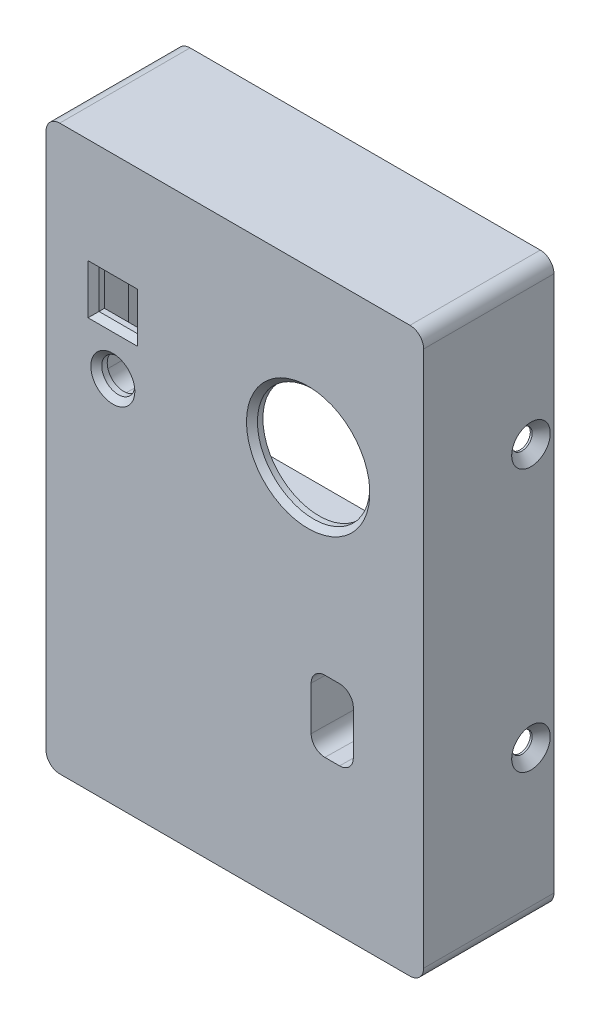
from build123d import *

# Parameters (mm, degrees)
SKETCH2_W            = 69
SKETCH2_H            = 103
BOSS_EXTRUDE1_DEPTH  = 2
SKETCH3_W            = 69
SKETCH3_H            = 103
SKETCH3_W_2          = 65
SKETCH3_H_2          = 99
BOSS_EXTRUDE2_DEPTH  = 21.816
BOSS_EXTRUDE3_DEPTH  = 7.5
SKETCH7_R            = 10.271022242
SKETCH7_R_2          = 3.021022242
SKETCH7_W            = 7.042044484
SKETCH7_H            = 7.042044484
CUT_EXTRUDE1_DEPTH   = 84.899212487
SKETCH9_W            = 1.5
SKETCH9_H            = 7
SKETCH9_H_2          = 8.825
BOSS_EXTRUDE4_DEPTH  = 19.69
BOSS_EXTRUDE5_DEPTH  = 21.3
SKETCH10_W           = 10.7
SKETCH10_H           = 4.1
BOSS_EXTRUDE6_DEPTH  = 15.33
BOSS_EXTRUDE7_DEPTH  = 19.69
SKETCH10_6_W         = 5
SKETCH10_6_H         = 2
BOSS_EXTRUDE8_DEPTH  = 21.3
SKETCH11_W           = 7.5
SKETCH11_H           = 13
CUT_EXTRUDE2_DEPTH   = 84.899212487
FILLET2_R            = 2.5
CHAMFER1_SIZE        = 1
CUT_EXTRUDE3_REACH   = 112.793
SKETCH12_W           = 1
SKETCH12_H           = 11.908
SKETCH13_W           = 12.35
SKETCH13_H           = 16.65
SKETCH13_W_2         = 7.5
SKETCH13_H_2         = 13
BOSS_EXTRUDE9_DEPTH  = 14.69
SKETCH14_W           = 7.5
SKETCH14_H           = 13
BOSS_EXTRUDE10_DEPTH = 5.1
DRAFT1_ANGLE         = 1
FILLET3_R            = 2.5
SKETCH16_W           = 2.65
SKETCH16_H           = 3
SKETCH16_W_2         = 1.65
SKETCH16_W_3         = 2.15
SKETCH16_H_2         = 2.15
BOSS_EXTRUDE12_DEPTH = 22.8
SKETCH16_4_W         = 1.35
SKETCH16_4_H         = 3
BOSS_EXTRUDE13_DEPTH = 23.816
BOSS_EXTRUDE14_DEPTH = 21.816
CUT_EXTRUDE4_DEPTH   = 5.15
CUT_EXTRUDE5_DEPTH   = 5.15
SKETCH19_R           = 1.875
CUT_EXTRUDE6_DEPTH   = 2
CHAMFER5_SIZE        = 1.65
SKETCH20_W           = 15.485542106
SKETCH20_H           = 0.75
CUT_EXTRUDE7_DEPTH   = 3
BOSS_EXTRUDE15_DEPTH = 5
BOSS_EXTRUDE16_DEPTH = 6.61
SKETCH23_W           = 1.5
SKETCH23_H           = 2
CUT_EXTRUDE8_DEPTH   = 1


with BuildPart() as part:
    # Sketch2 → Boss-Extrude1 (new body)
    with BuildSketch(Plane.XY):
        with Locations((0, -21.8)):
            Rectangle(SKETCH2_W, SKETCH2_H)
    extrude(amount=BOSS_EXTRUDE1_DEPTH)

    # Sketch3 → Boss-Extrude2 (add)
    with BuildSketch(Plane(origin=(0, 0, 0), x_dir=(-1, 0, 0), z_dir=(0, 0, -1))):
        with Locations((0, -21.8)):
            Rectangle(SKETCH3_W, SKETCH3_H)
        with Locations((0, -21.8)):
            Rectangle(SKETCH3_W_2, SKETCH3_H_2, mode=Mode.SUBTRACT)
    extrude(amount=BOSS_EXTRUDE2_DEPTH)

    # Sketch4 → Boss-Extrude3 (add)
    with BuildSketch(Plane(origin=(0, 0, 0), x_dir=(-1, 0, 0), z_dir=(0, 0, -1))):
        with BuildLine():
            Line((30.45, -10.5), (30.45, -8.939131361))
            Line((30.45, -8.939131361), (30.45, -8.190100036))
            Line((30.45, -8.190100036), (30.45, -6.895046928))
            Line((30.45, -6.895046928), (30.45, -2.388728371))
            Line((30.45, -2.388728371), (30.45, -1.262895346))
            Line((30.45, -1.262895346), (30.45, 3.240436753))
            Line((30.45, 3.240436753), (30.45, 8.176781555))
            Line((30.45, 8.176781555), (30.45, 9.5))
            ThreePointArc((30.45, 9.5), (29.20520382, 12.50520382), (26.2, 13.75))
            Line((26.2, 13.75), (18.363486262, 13.75))
            Line((18.363486262, 13.75), (15.826316186, 13.75))
            Line((15.826316186, 13.75), (13.150363034, 13.75))
            Line((13.150363034, 13.75), (10.049377385, 13.75))
            Line((10.049377385, 13.75), (-0.851077026, 13.75))
            Line((-0.851077026, 13.75), (-3.379023688, 13.75))
            Line((-3.379023688, 13.75), (-11.06242881, 13.75))
            Line((-11.06242881, 13.75), (-13.130748807, 13.75))
            Line((-13.130748807, 13.75), (-21.9, 13.75))
            ThreePointArc((-21.9, 13.75), (-25.875002513, 12.154738863), (-27.644381712, 8.254123485))
            ThreePointArc((-27.644381712, 8.254123485), (-27.648595256, 8.127092792), (-27.65, 8))
            Line((-27.65, 8), (-27.65, 3.240436753))
            Line((-27.65, 3.240436753), (-27.65, -1.262895346))
            Line((-27.65, -1.262895346), (-27.65, -2.388728371))
            Line((-27.65, -2.388728371), (-27.65, -6.895046928))
            Line((-27.65, -6.895046928), (-27.65, -8.190100036))
            Line((-27.65, -8.190100036), (-27.65, -8.939131361))
            Line((-27.65, -8.939131361), (-27.65, -9))
            ThreePointArc((-27.65, -9), (-27.523411678, -10.19989212), (-27.149220487, -11.346952125))
            ThreePointArc((-27.149220487, -11.346952125), (-25.027900676, -13.824804386), (-21.9, -14.75))
            Line((-21.9, -14.75), (-13.130748807, -14.75))
            Line((-13.130748807, -14.75), (-11.06242881, -14.75))
            Line((-11.06242881, -14.75), (-3.379023688, -14.75))
            Line((-3.379023688, -14.75), (-0.851077026, -14.75))
            Line((-0.851077026, -14.75), (10.049377385, -14.75))
            Line((10.049377385, -14.75), (13.150363034, -14.75))
            Line((13.150363034, -14.75), (15.826316186, -14.75))
            Line((15.826316186, -14.75), (18.363486262, -14.75))
            Line((18.363486262, -14.75), (26.2, -14.75))
            ThreePointArc((26.2, -14.75), (29.124381519, -13.583908678), (30.44401202, -10.725525992))
            ThreePointArc((30.44401202, -10.725525992), (30.448502741, -10.612802736), (30.45, -10.5))
        make_face()
        with BuildLine():
            Line((26.2, -13.25), (18.363486262, -13.25))
            Line((18.363486262, -13.25), (15.826316186, -13.25))
            Line((15.826316186, -13.25), (13.150363034, -13.25))
            Line((13.150363034, -13.25), (10.049377385, -13.25))
            Line((10.049377385, -13.25), (-0.851077026, -13.25))
            Line((-0.851077026, -13.25), (-3.379023688, -13.25))
            Line((-3.379023688, -13.25), (-11.06242881, -13.25))
            Line((-11.06242881, -13.25), (-13.130748807, -13.25))
            Line((-13.130748807, -13.25), (-21.9, -13.25))
            ThreePointArc((-21.9, -13.25), (-24.211926587, -12.566159763), (-25.779858621, -10.734703745))
            ThreePointArc((-25.779858621, -10.734703745), (-26.056434719, -9.886876784), (-26.15, -9))
            Line((-26.15, -9), (-26.15, -8.939131361))
            Line((-26.15, -8.939131361), (-26.15, -8.190100036))
            Line((-26.15, -8.190100036), (-26.15, -6.895046928))
            Line((-26.15, -6.895046928), (-26.15, -2.388728371))
            Line((-26.15, -2.388728371), (-26.15, -1.262895346))
            Line((-26.15, -1.262895346), (-26.15, 3.240436753))
            Line((-26.15, 3.240436753), (-26.15, 8))
            ThreePointArc((-26.15, 8), (-26.148961711, 8.09393815), (-26.145847352, 8.187830402))
            ThreePointArc((-26.145847352, 8.187830402), (-24.838045336, 11.070893942), (-21.9, 12.25))
            Line((-21.9, 12.25), (-13.130748807, 12.25))
            Line((-13.130748807, 12.25), (-11.06242881, 12.25))
            Line((-11.06242881, 12.25), (-3.379023688, 12.25))
            Line((-3.379023688, 12.25), (-0.851077026, 12.25))
            Line((-0.851077026, 12.25), (10.049377385, 12.25))
            Line((10.049377385, 12.25), (13.150363034, 12.25))
            Line((13.150363034, 12.25), (15.826316186, 12.25))
            Line((15.826316186, 12.25), (18.363486262, 12.25))
            Line((18.363486262, 12.25), (26.2, 12.25))
            ThreePointArc((26.2, 12.25), (28.144543648, 11.444543648), (28.95, 9.5))
            Line((28.95, 9.5), (28.95, 8.176781555))
            Line((28.95, 8.176781555), (28.95, 3.240436753))
            Line((28.95, 3.240436753), (28.95, -1.262895346))
            Line((28.95, -1.262895346), (28.95, -2.388728371))
            Line((28.95, -2.388728371), (28.95, -6.895046928))
            Line((28.95, -6.895046928), (28.95, -8.190100036))
            Line((28.95, -8.190100036), (28.95, -8.939131361))
            Line((28.95, -8.939131361), (28.95, -10.5))
            ThreePointArc((28.95, -10.5), (28.949031186, -10.572990006), (28.946125425, -10.645928583))
            ThreePointArc((28.946125425, -10.645928583), (28.092246865, -12.495470321), (26.2, -13.25))
        make_face(mode=Mode.SUBTRACT)
    extrude(amount=BOSS_EXTRUDE3_DEPTH)

    # Sketch7 → Cut-Extrude1 (cut, through all)
    with BuildSketch(Plane(origin=(0, 0, 0), x_dir=(-1, 0, 0), z_dir=(0, 0, -1))):
        with Locations((-13.4, -0.5)):
            Circle(SKETCH7_R)
        with Locations((22.3, -5.9)):
            Circle(SKETCH7_R_2)
        with Locations((22.3, 6)):
            Rectangle(SKETCH7_W, SKETCH7_H)
    extrude(amount=-CUT_EXTRUDE1_DEPTH, mode=Mode.SUBTRACT)

    # Sketch9 → Boss-Extrude4 (add)
    with BuildSketch(Plane(origin=(0, 0, 0), x_dir=(-1, 0, 0), z_dir=(0, 0, -1))):
        with Locations((-22.25, -64.8)):
            Rectangle(SKETCH9_W, SKETCH9_H)
        with Locations((21.25, -63.8875)):
            Rectangle(SKETCH9_W, SKETCH9_H_2)
    extrude(amount=BOSS_EXTRUDE4_DEPTH)

    # Sketch9<4> → Boss-Extrude5 (add)
    with BuildSketch(Plane(origin=(0, 0, 0), x_dir=(-1, 0, 0), z_dir=(0, 0, -1))):
        Polygon((-25, -61.3), (-25, -71.3), (-21.5, -71.3), (-21.5, -68.3), (-23, -68.3), (-23, -61.3), align=None)
        Polygon((20.5, -70.3), (24, -70.3), (24, -59.475), (22, -59.475), (22, -68.3), (20.5, -68.3), align=None)
    extrude(amount=BOSS_EXTRUDE5_DEPTH)

    # Sketch10 → Boss-Extrude6 (add)
    with BuildSketch(Plane(origin=(0, 0, 0), x_dir=(-1, 0, 0), z_dir=(0, 0, -1))):
        with Locations((15.6, -36.1625)):
            Rectangle(SKETCH10_W, SKETCH10_H)
    extrude(amount=BOSS_EXTRUDE6_DEPTH)

    # Sketch10<4> → Boss-Extrude7 (add)
    with BuildSketch(Plane(origin=(0, 0, 0), x_dir=(-1, 0, 0), z_dir=(0, 0, -1))):
        Polygon((20.95, -38.2125), (22, -38.2125), (22, -33.3), (20.95, -33.3), (20.95, -34.1125), align=None)
        Polygon((5.25, -38.2125), (10.25, -38.2125), (10.25, -34.1125), (10.25, -33.3), (5.25, -33.3), align=None)
    extrude(amount=BOSS_EXTRUDE7_DEPTH)

    # Sketch10<6> → Boss-Extrude8 (add)
    with BuildSketch(Plane(origin=(0, 0, 0), x_dir=(-1, 0, 0), z_dir=(0, 0, -1))):
        with Locations((7.75, -32.3)):
            Rectangle(SKETCH10_6_W, SKETCH10_6_H)
        Polygon((22, -38.2125), (22, -46.325), (24, -46.325), (24, -31.3), (20.95, -31.3), (20.95, -33.3), (22, -33.3), align=None)
    extrude(amount=BOSS_EXTRUDE8_DEPTH)

    # Sketch11 → Cut-Extrude2 (cut, through all)
    with BuildSketch(Plane(origin=(0, 0, 0), x_dir=(-1, 0, 0), z_dir=(0, 0, -1))):
        with Locations((-17.9, -39.95)):
            Rectangle(SKETCH11_W, SKETCH11_H)
    extrude(amount=-CUT_EXTRUDE2_DEPTH, mode=Mode.SUBTRACT)

    # Fillet2
    fillet2_edges = [part.edges().sort_by_distance(p)[0] for p in [
        (-34.5, 29.7, -9.908),
        (34.5, 29.7, -9.908),
        (34.5, -73.3, -9.908),
        (-34.5, -73.3, -9.908),
    ]]
    fillet(fillet2_edges, radius=FILLET2_R)

    # Chamfer1
    chamfer1_edges = [part.edges().sort_by_distance(p)[0] for p in [
        (23.671022242, -0.5, 2),
        (-19.278977758, -5.9, 2),
        (-25.821022242, 6, 2),
        (-22.3, 2.478977758, 2),
        (-18.778977758, 6, 2),
        (-22.3, 9.521022242, 2),
    ]]
    chamfer(chamfer1_edges, length=CHAMFER1_SIZE)

    # Sketch12 → Cut-Extrude3 (cut, up to next)
    with BuildSketch(Plane.XZ.offset(73.3), mode=Mode.PRIVATE) as cut_extrude3_sk1:
        with Locations((-23.360094853, -15.862)):
            Rectangle(SKETCH12_W, SKETCH12_H)
    cut_extrude3_tool1 = extrude(cut_extrude3_sk1.sketch, amount=-CUT_EXTRUDE3_REACH, mode=Mode.PRIVATE) & part.part
    # Sketch12 → Cut-Extrude3 (cut, up to next)
    with BuildSketch(Plane.XZ.offset(73.3), mode=Mode.PRIVATE) as cut_extrude3_sk2:
        with Locations((-12.360094853, -15.862)):
            Rectangle(SKETCH12_W, SKETCH12_H)
    cut_extrude3_tool2 = extrude(cut_extrude3_sk2.sketch, amount=-CUT_EXTRUDE3_REACH, mode=Mode.PRIVATE) & part.part
    add(cut_extrude3_tool1.solids().sort_by_distance((-23.360095, -73.3, -15.862))[0], mode=Mode.SUBTRACT)
    add(cut_extrude3_tool2.solids().sort_by_distance((-12.360095, -73.3, -15.862))[0], mode=Mode.SUBTRACT)

    # Sketch13 → Boss-Extrude9 (add)
    with BuildSketch(Plane(origin=(0, 0, 0), x_dir=(-1, 0, 0), z_dir=(0, 0, -1))):
        with Locations((-18.825, -39.625)):
            Rectangle(SKETCH13_W, SKETCH13_H)
        with Locations((-17.9, -39.95)):
            Rectangle(SKETCH13_W_2, SKETCH13_H_2, mode=Mode.SUBTRACT)
    extrude(amount=BOSS_EXTRUDE9_DEPTH)

    # Sketch14 → Boss-Extrude10 (add)
    # profile 1 of 2: a face of its own
    with BuildSketch(Plane(origin=(0, 0, -14.69), x_dir=(-1, 0, 0), z_dir=(0, 0, -1))):
        with Locations((-17.9, -39.95)):
            Rectangle(SKETCH14_W, SKETCH14_H)
        with BuildLine():
            Line((-17.62, -35.355), (-18.18, -35.355))
            ThreePointArc((-18.18, -35.355), (-19.187627163, -35.772372837), (-19.605, -36.78))
            Line((-19.605, -36.78), (-19.605, -43.12))
            ThreePointArc((-19.605, -43.12), (-19.187627163, -44.127627163), (-18.18, -44.545))
            Line((-18.18, -44.545), (-17.62, -44.545))
            ThreePointArc((-17.62, -44.545), (-16.612372837, -44.127627163), (-16.195, -43.12))
            Line((-16.195, -43.12), (-16.195, -36.78))
            ThreePointArc((-16.195, -36.78), (-16.612372837, -35.772372837), (-17.62, -35.355))
        make_face(mode=Mode.SUBTRACT)
    # profile 2 of 2: a face of its own
    with BuildSketch(Plane(origin=(0, 0, -14.69), x_dir=(-1, 0, 0), z_dir=(0, 0, -1))):
        with BuildLine():
            Line((-17.62, -35.48), (-18.18, -35.48))
            ThreePointArc((-18.18, -35.48), (-19.099238816, -35.860761184), (-19.48, -36.78))
            Line((-19.48, -36.78), (-19.48, -43.12))
            ThreePointArc((-19.48, -43.12), (-19.099238816, -44.039238816), (-18.18, -44.42))
            Line((-18.18, -44.42), (-17.62, -44.42))
            ThreePointArc((-17.62, -44.42), (-16.700761184, -44.039238816), (-16.32, -43.12))
            Line((-16.32, -43.12), (-16.32, -36.78))
            ThreePointArc((-16.32, -36.78), (-16.700761184, -35.860761184), (-17.62, -35.48))
        make_face()
    extrude(amount=-BOSS_EXTRUDE10_DEPTH)


with BuildPart() as boss_extrude10_kept_piece:
    # of the separate pieces the step leaves, the one the design keeps (boss_extrude10_pieces_kept)
    add(part.part.solids().sort_by_distance((2.128977758, -0.5, 2))[0])

    # Draft1
    draft1_faces = [boss_extrude10_kept_piece.faces().sort_by_distance(p)[0] for p in [
        (14.15, -39.95, -3.795),
    ]]
    draft(draft1_faces, Plane.XY.offset(-9.59), DRAFT1_ANGLE)

    # Fillet3
    fillet3_edges = [boss_extrude10_kept_piece.edges().sort_by_distance(p)[0] for p in [
        (14.048847899, -33.45, -3.795),
        (14.048847899, -46.45, -3.795),
        (21.65, -46.45, -3.795),
        (21.65, -33.45, -3.795),
    ]]
    fillet(fillet3_edges, radius=FILLET3_R)

    # Sketch16 → Boss-Extrude12 (add)
    with BuildSketch(Plane(origin=(0, 0, 0), x_dir=(-1, 0, 0), z_dir=(0, 0, -1))):
        with Locations((25.325, -69.3)):
            Rectangle(SKETCH16_W, SKETCH16_H)
        with Locations((-25.825, -69.3)):
            Rectangle(SKETCH16_W_2, SKETCH16_H)
        with Locations((25.575, 21.275)):
            Rectangle(SKETCH16_W_3, SKETCH16_H_2)
        with Locations((-25.575, 21.275)):
            Rectangle(SKETCH16_W_3, SKETCH16_H_2)
    extrude(amount=BOSS_EXTRUDE12_DEPTH)

    # Sketch16<4> → Boss-Extrude13 (add)
    with BuildSketch(Plane(origin=(0, 0, 0), x_dir=(-1, 0, 0), z_dir=(0, 0, -1))):
        with Locations((27.325, -69.3)):
            Rectangle(SKETCH16_4_W, SKETCH16_4_H)
        with Locations((-27.325, -69.3)):
            Rectangle(SKETCH16_4_W, SKETCH16_4_H)
        Polygon((28.5, 20.2), (28.5, 24.2), (24.5, 24.2), (24.5, 22.35), (26.65, 22.35), (26.65, 20.2), align=None)
        Polygon((-24.5, 22.35), (-24.5, 24.2), (-28.5, 24.2), (-28.5, 20.2), (-26.65, 20.2), (-26.65, 22.35), align=None)
    extrude(amount=BOSS_EXTRUDE13_DEPTH)

    # Sketch16<5> → Boss-Extrude14 (add)
    with BuildSketch(Plane(origin=(0, 0, 0), x_dir=(-1, 0, 0), z_dir=(0, 0, -1))):
        Polygon((-25, -71.3), (-25, -70.8), (-26.65, -70.8), (-28, -70.8), (-28, -71.3), align=None)
        Polygon((26.65, -70.8), (24, -70.8), (24, -71.3), (28, -71.3), (28, -70.8), align=None)
    extrude(amount=BOSS_EXTRUDE14_DEPTH)

    # Sketch17 → Cut-Extrude4 (cut, symmetric)
    with BuildSketch(Plane(origin=(0, -43.8, -23.308), x_dir=(0, 0, 1), z_dir=(0, -1, 0))):
        Polygon((5.692, 32.5), (5.692, 33.895833333), (9.042, 32.5), align=None)
    extrude(amount=CUT_EXTRUDE4_DEPTH, both=True, mode=Mode.SUBTRACT)

    # Sketch18 → Cut-Extrude5 (cut, symmetric)
    with BuildSketch(Plane(origin=(0, 0.2, -23.308), x_dir=(0, 0, -1), z_dir=(0, 1, 0))):
        Polygon((-5.692, 32.5), (-5.692, 33.895833333), (-9.042, 32.5), align=None)
    extrude(amount=CUT_EXTRUDE5_DEPTH, both=True, mode=Mode.SUBTRACT)

    # Sketch19 → Cut-Extrude6 (cut)
    with BuildSketch(Plane(origin=(34.5, 0, 0), x_dir=(0, 0, -1), z_dir=(1, 0, 0))):
        with Locations(Location((17.616, -45.7, 0), (0, 0, 90))):
            Circle(SKETCH19_R)
        with Locations(Location((17.616, 2.3, 0), (0, 0, 90))):
            Circle(SKETCH19_R)
    extrude(amount=-CUT_EXTRUDE6_DEPTH, mode=Mode.SUBTRACT)

    # Chamfer5
    chamfer5_edges = [boss_extrude10_kept_piece.edges().sort_by_distance(p)[0] for p in [
        (34.5, -47.575, -17.616),
        (34.5, 0.425, -17.616),
    ]]
    chamfer(chamfer5_edges, length=CHAMFER5_SIZE)

    # Sketch20 → Cut-Extrude7 (cut)
    with BuildSketch(Plane(origin=(0, 0, -21.816), x_dir=(-1, 0, 0), z_dir=(0, 0, -1))):
        with Locations((-0.407228947, -71.675)):
            Rectangle(SKETCH20_W, SKETCH20_H)
    extrude(amount=-CUT_EXTRUDE7_DEPTH, mode=Mode.SUBTRACT)

    # Sketch22 → Boss-Extrude15 (add)
    with BuildSketch(Plane(origin=(0, 0, -14.69), x_dir=(-1, 0, 0), z_dir=(0, 0, -1))):
        Polygon((-16, -34.8), (-16, -33.3), (-23, -33.3), (-23, -40.3), (-21.5, -40.3), (-21.5, -34.8), align=None)
    extrude(amount=BOSS_EXTRUDE15_DEPTH)

    # Sketch22<4> → Boss-Extrude16 (add)
    with BuildSketch(Plane(origin=(0, 0, -14.69), x_dir=(-1, 0, 0), z_dir=(0, 0, -1))):
        Polygon((-16, -33.3), (-16, -31.3), (-25, -31.3), (-25, -40.3), (-23, -40.3), (-23, -33.3), align=None)
    extrude(amount=BOSS_EXTRUDE16_DEPTH)

    # Sketch23 → Cut-Extrude8 (cut)
    with BuildSketch(Plane(origin=(0, 0, -19.69), x_dir=(-1, 0, 0), z_dir=(0, 0, -1))):
        with Locations((-22.25, -35.8)):
            Rectangle(SKETCH23_W, SKETCH23_H)
    extrude(amount=-CUT_EXTRUDE8_DEPTH, mode=Mode.SUBTRACT)


solid = boss_extrude10_kept_piece.part
